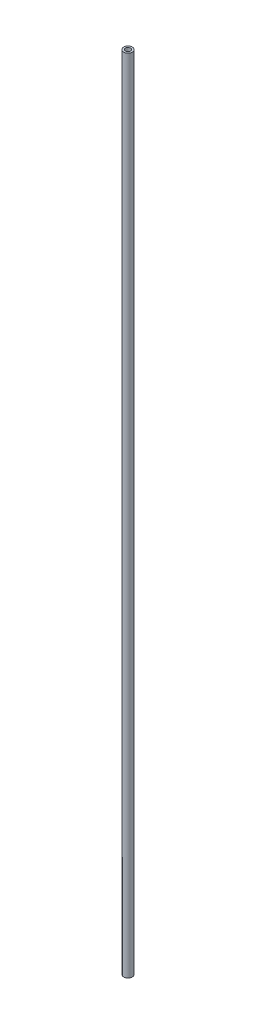
from build123d import *

# Parameters (mm, degrees)
SKETCH1_R           = 3
BOSS_EXTRUDE1_DEPTH = 550
SKETCH2_R           = 1.75
CUT_EXTRUDE1_DEPTH  = 10


with BuildPart() as part:
    # Sketch1 → Boss-Extrude1 (new body)
    with BuildSketch(Plane(origin=(0, 0, 0), x_dir=(1, 0, 0), z_dir=(0, 1, 0))):
        with Locations(Location((0, 0, 0), (0, 0, 270))):
            Circle(SKETCH1_R)
    extrude(amount=BOSS_EXTRUDE1_DEPTH)

    # Sketch2 → Cut-Extrude1 (cut)
    with BuildSketch(Plane(origin=(0, 550, 0), x_dir=(1, 0, 0), z_dir=(0, 1, 0))):
        with Locations(Location((0, 0, 0), (0, 0, 270))):
            Circle(SKETCH2_R)
    extrude(amount=-CUT_EXTRUDE1_DEPTH, mode=Mode.SUBTRACT)


solid = part.part
